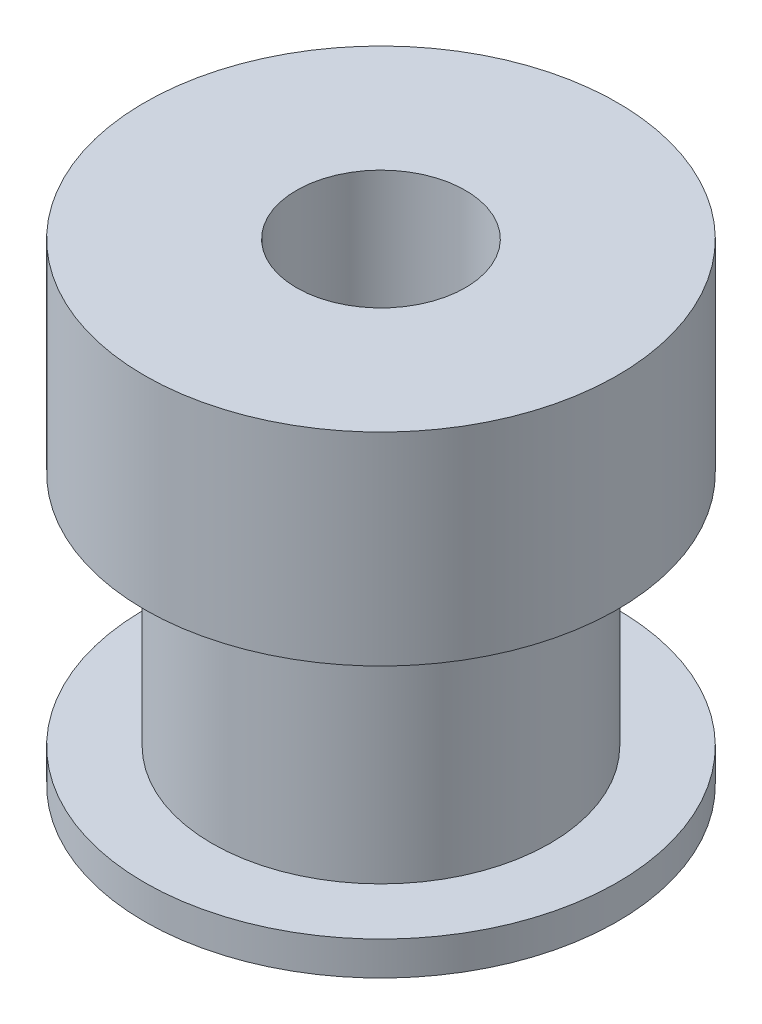
from build123d import *

# Parameters (mm, degrees)
SKETCH1_R           = 7
BOSS_EXTRUDE1_DEPTH = 1
SKETCH2_R           = 5
BOSS_EXTRUDE2_DEPTH = 7
SKETCH3_R           = 7
BOSS_EXTRUDE3_DEPTH = 6
SKETCH4_R           = 2.5
CUT_EXTRUDE1_DEPTH  = 14


with BuildPart() as part:
    # Sketch1 → Boss-Extrude1 (new body)
    with BuildSketch(Plane(origin=(0, 0, 0), x_dir=(1, 0, 0), z_dir=(0, 1, 0))):
        with Locations(Location((0, 0, 0), (0, 0, 270))):
            Circle(SKETCH1_R)
    extrude(amount=BOSS_EXTRUDE1_DEPTH)

    # Sketch2 → Boss-Extrude2 (add)
    with BuildSketch(Plane(origin=(0, 1, 0), x_dir=(1, 0, 0), z_dir=(0, 1, 0))):
        with Locations(Location((0, 0, 0), (0, 0, 270))):
            Circle(SKETCH2_R)
    extrude(amount=BOSS_EXTRUDE2_DEPTH)

    # Sketch3 → Boss-Extrude3 (add)
    with BuildSketch(Plane(origin=(0, 8, 0), x_dir=(1, 0, 0), z_dir=(0, 1, 0))):
        with Locations(Location((0, 0, 0), (0, 0, 270))):
            Circle(SKETCH3_R)
    extrude(amount=BOSS_EXTRUDE3_DEPTH)

    # Sketch4 → Cut-Extrude1 (cut)
    with BuildSketch(Plane(origin=(0, 14, 0), x_dir=(1, 0, 0), z_dir=(0, 1, 0))):
        with Locations(Location((0, 0, 0), (0, 0, 270))):
            Circle(SKETCH4_R)
    extrude(amount=-CUT_EXTRUDE1_DEPTH, mode=Mode.SUBTRACT)


solid = part.part
